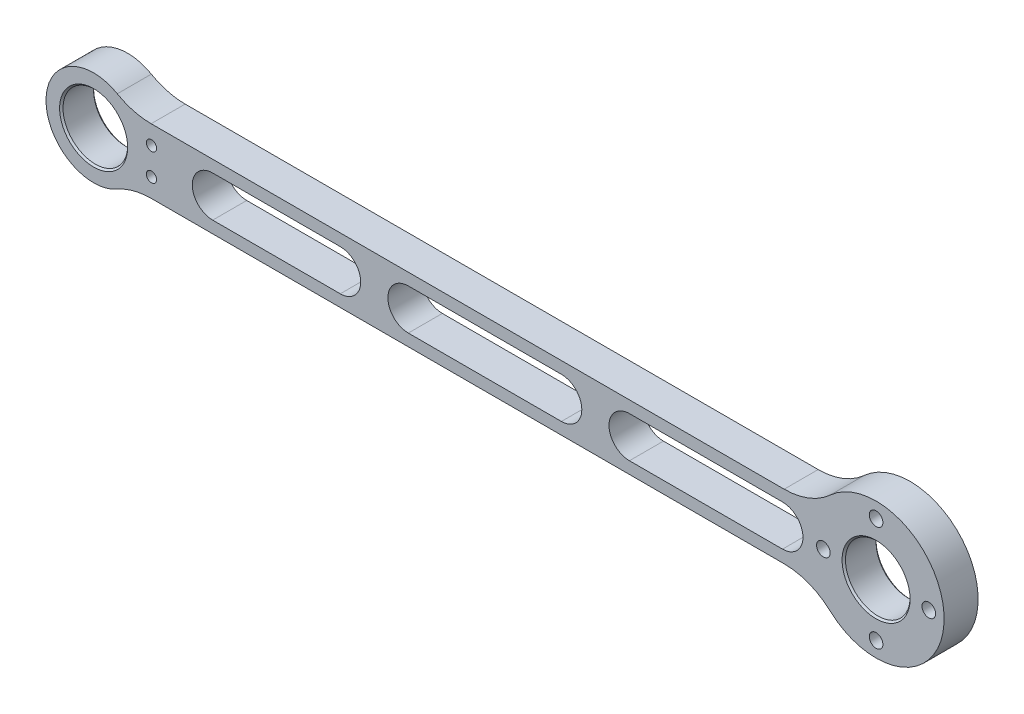
from build123d import *

# Parameters (mm, degrees)
SKETCH_1_R               = 9.5
EXTRUDE_2_DEPTH          = 10
CHAMFER_1_SIZE           = 0.5
CUT_EXTRUDE_1_DEPTH      = 10
SKETCH_3_R               = 2
CUT_EXTRUDE_2_DEPTH      = 10
CHAMFER_2_SIZE           = 0.5
SKETCH_5_R               = 2
CUT_EXTRUDE_3_DEPTH      = 10
CHAMFER_3_SIZE           = 0.5
SKETCH_9_R               = 2
EXTRUDE_3_DEPTH          = 10
CUT_EXTRUDE_6_DEPTH      = 10
PATTERN_CIRCULAR_2_COUNT = 4
SKETCH_11_R              = 1.5
CUT_EXTRUDE_7_DEPTH      = 251.99800796


with BuildPart() as part:
    # 草图1 → 凸台-拉伸2 (new body)
    with BuildSketch(Plane.XY):
        with BuildLine():
            Line((20.821645942, -9.5), (202.986114682, -9.5))
            ThreePointArc((202.986114682, -9.5), (210.231803055, -10.858648118), (216.493057341, -14.75))
            ThreePointArc((216.493057341, -14.75), (250, 0), (216.493057341, 14.75))
            ThreePointArc((216.493057341, 14.75), (210.231803055, 10.858648118), (202.986114682, 9.5))
            Line((202.986114682, 9.5), (21.63860854, 9.5))
            Line((21.63860854, 9.5), (16.904141504, 9.5))
            ThreePointArc((16.904141504, 9.5), (11.75918395, 10.173090993), (6.960528855, 12.147058824))
            ThreePointArc((6.960528855, 12.147058824), (3.490452231, 13.557903349), (-0.229510749, 13.998118617))
            ThreePointArc((-0.229510749, 13.998118617), (-13.878745314, -1.838594167), (3.423256182, -13.575025492))
            ThreePointArc((3.423256182, -13.575025492), (5.240755683, -12.982083033), (6.960528855, -12.147058824))
            ThreePointArc((6.960528855, -12.147058824), (11.75918395, -10.173090993), (16.904141504, -9.5))
            Line((16.904141504, -9.5), (20.821645942, -9.5))
        make_face()
        Circle(SKETCH_1_R, mode=Mode.SUBTRACT)
        with Locations((230, 0)):
            Circle(SKETCH_1_R, mode=Mode.SUBTRACT)
    extrude(amount=EXTRUDE_2_DEPTH)

    # 倒角1
    chamfer_1_edges = [part.edges().sort_by_distance(p)[0] for p in [
        (-9.5, 0, 10),
        (-9.5, 0, 0),
    ]]
    chamfer(chamfer_1_edges, length=CHAMFER_1_SIZE)

    # 草图2 → 切除-拉伸1 (cut)
    with BuildSketch(Plane.XY.offset(10)):
        with BuildLine():
            Line((92.5, -6), (137.5, -6))
            ThreePointArc((137.5, -6), (143.5, 0), (137.5, 6))
            Line((137.5, 6), (92.5, 6))
            ThreePointArc((92.5, 6), (86.5, 0), (92.5, -6))
        make_face()
        with BuildLine():
            Line((157.5, -6), (202.5, -6))
            ThreePointArc((202.5, -6), (208.5, 0), (202.5, 6))
            Line((202.5, 6), (157.5, 6))
            ThreePointArc((157.5, 6), (151.5, 0), (157.5, -6))
        make_face()
        with BuildLine():
            Line((35, -6), (72.5, -6))
            ThreePointArc((72.5, -6), (78.5, 0), (72.5, 6))
            Line((72.5, 6), (35, 6))
            ThreePointArc((35, 6), (29, 0), (35, -6))
        make_face()
    extrude(amount=-CUT_EXTRUDE_1_DEPTH, mode=Mode.SUBTRACT)

    # 草图3 → 切除-拉伸2 (cut)
    with BuildSketch(Plane.XY.offset(10)):
        with Locations((222.5, 12.990381057)):
            Circle(SKETCH_3_R)
        with Locations((237.5, 12.990381057)):
            Circle(SKETCH_3_R)
        with Locations((245, 0)):
            Circle(SKETCH_3_R)
    extrude(amount=-CUT_EXTRUDE_2_DEPTH, mode=Mode.SUBTRACT)

    # 倒角2
    chamfer_2_edges = [part.edges().sort_by_distance(p)[0] for p in [
        (220.5, 0, 10),
    ]]
    chamfer(chamfer_2_edges, length=CHAMFER_2_SIZE)

    # 草图5 → 切除-拉伸3 (cut)
    with BuildSketch(Plane.XY.offset(10)):
        with Locations((215, 0)):
            Circle(SKETCH_5_R)
        with Locations((222.5, -12.990381057)):
            Circle(SKETCH_5_R)
        with Locations((237.5, -12.990381057)):
            Circle(SKETCH_5_R)
    extrude(amount=-CUT_EXTRUDE_3_DEPTH, mode=Mode.SUBTRACT)

    # 倒角3
    chamfer_3_edges = [part.edges().sort_by_distance(p)[0] for p in [
        (220.5, 0, 0),
    ]]
    chamfer(chamfer_3_edges, length=CHAMFER_3_SIZE)

    # 草图9 → 凸台-拉伸3 (add)
    with BuildSketch(Plane.XY.offset(10)):
        with Locations((215, 0)):
            Circle(SKETCH_9_R)
        with Locations((222.5, 12.990381057)):
            Circle(SKETCH_9_R)
        with Locations((237.5, 12.990381057)):
            Circle(SKETCH_9_R)
        with Locations((245, 0)):
            Circle(SKETCH_9_R)
        with Locations((237.5, -12.990381057)):
            Circle(SKETCH_9_R)
        with Locations((222.5, -12.990381057)):
            Circle(SKETCH_9_R)
    extrude(amount=-EXTRUDE_3_DEPTH)

    # 草图10 → 切除-拉伸6 (cut)
    with BuildSketch(Plane.XY.offset(10)):
        with BuildLine():
            ThreePointArc((214.629032258, -1.995833329), (215.959120371, -1.367833229), (216.5, 0))
            ThreePointArc((216.5, 0), (215.959120371, 1.367833229), (214.629032258, 1.995833329))
            ThreePointArc((214.629032258, 1.995833329), (212.5, 0), (214.629032258, -1.995833329))
        make_face()
    cut_extrude_6 = extrude(amount=-CUT_EXTRUDE_6_DEPTH, mode=Mode.SUBTRACT)

    # 阵列(圆周)2: 切除-拉伸6 ×4 about axis
    pattern_circular_2_axis = Axis((230, 0, 9.5), (0, 0, -1))
    for i in range(1, PATTERN_CIRCULAR_2_COUNT):
        add(cut_extrude_6.rotate(pattern_circular_2_axis, i * 360 / PATTERN_CIRCULAR_2_COUNT), mode=Mode.SUBTRACT)

    # 草图11 → 切除-拉伸7 (cut, through all)
    with BuildSketch(Plane.XY.offset(10)):
        with Locations((17, 4)):
            Circle(SKETCH_11_R)
        with Locations((17, -4)):
            Circle(SKETCH_11_R)
    extrude(amount=-CUT_EXTRUDE_7_DEPTH, mode=Mode.SUBTRACT)


solid = part.part
